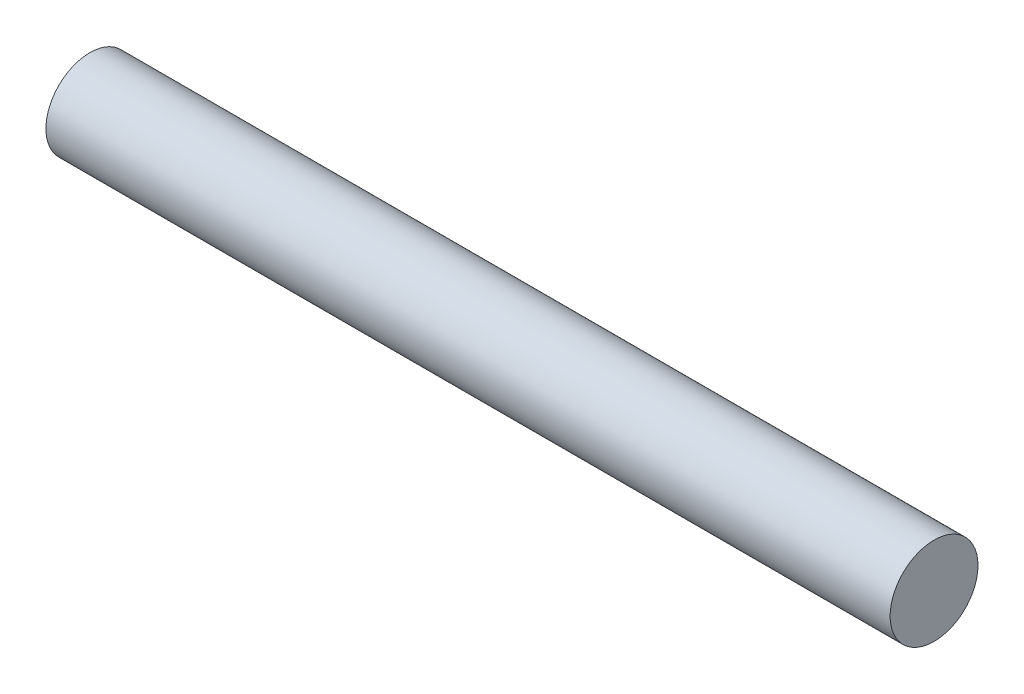
from build123d import *

# Parameters (mm, degrees)
SKETCH2_R           = 3.85
BOSS_EXTRUDE1_DEPTH = 37


with BuildPart() as part:
    # Sketch2 → Boss-Extrude1 (new, symmetric)
    with BuildSketch(Plane(origin=(0, 0, 0), x_dir=(0, 0, -1), z_dir=(1, 0, 0))):
        Circle(SKETCH2_R)
    extrude(amount=BOSS_EXTRUDE1_DEPTH, both=True)


solid = part.part
